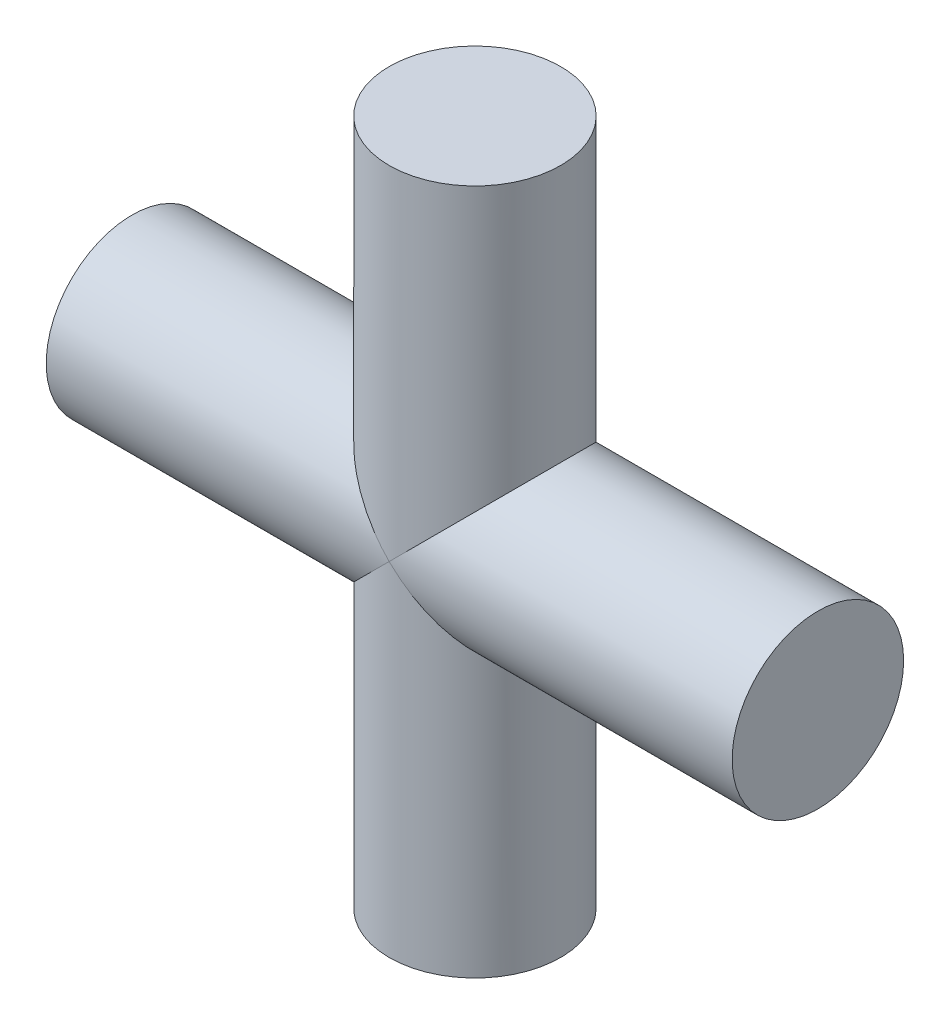
from build123d import *

# Parameters (mm, degrees)
BOSS_EXTRUDE1_DEPTH      = 20
BOSS_EXTRUDE1_DEPTH_BACK = 20
SKETCH1_R                = 5
BOSS_EXTRUDE2_DEPTH      = 20
BOSS_EXTRUDE2_DEPTH_BACK = 20
SKETCH2_R                = 5


with BuildPart() as part:
    # Sketch1 → Boss-Extrude1 (new, two sides: drawn at the far end of the back side and taken through both)
    with BuildSketch(Plane(origin=(0, 0, 0), x_dir=(0, 0, -1), z_dir=(1, 0, 0)).offset(-BOSS_EXTRUDE1_DEPTH_BACK)):
        Circle(SKETCH1_R)
    extrude(amount=BOSS_EXTRUDE1_DEPTH + BOSS_EXTRUDE1_DEPTH_BACK)

    # Sketch2 → Boss-Extrude2 (add, two sides: drawn at the far end of the back side and taken through both)
    with BuildSketch(Plane(origin=(0, 0, 0), x_dir=(1, 0, 0), z_dir=(0, 1, 0)).offset(-BOSS_EXTRUDE2_DEPTH_BACK)):
        Circle(SKETCH2_R)
    extrude(amount=BOSS_EXTRUDE2_DEPTH + BOSS_EXTRUDE2_DEPTH_BACK)


solid = part.part
